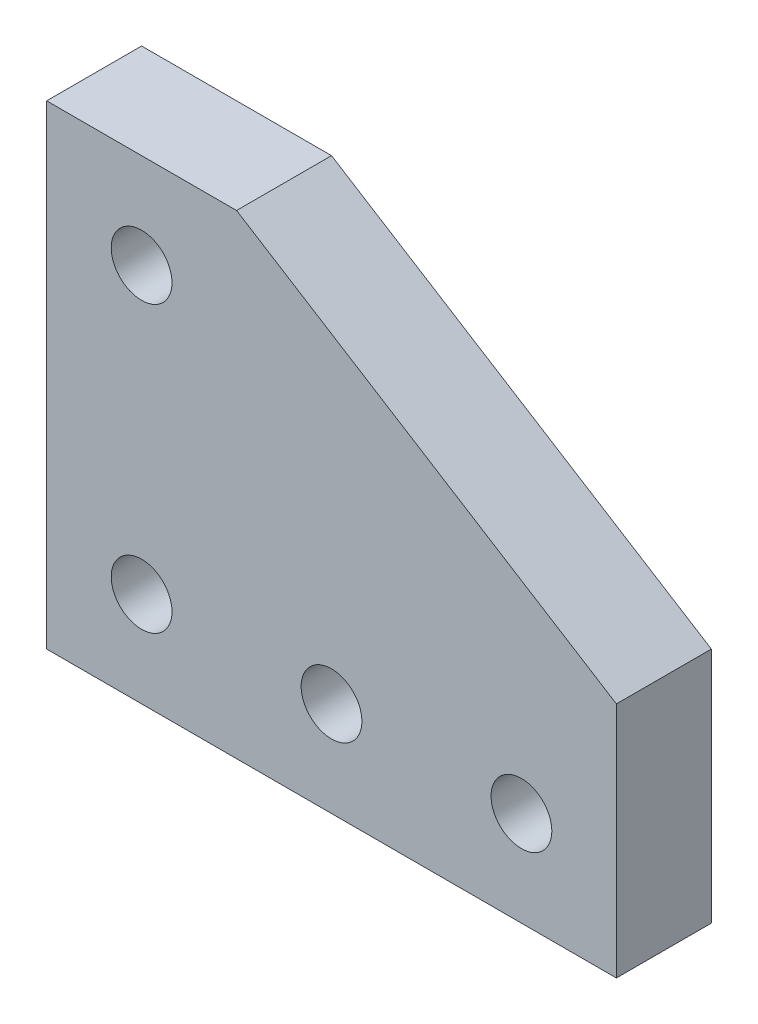
from build123d import *

# Parameters (mm, degrees)
SKETCH1_W               = 30
SKETCH1_H               = 25
BOSS_EXTRUDE1_DEPTH     = 5
CUT_EXTRUDE1_REACH      = 22.156
SKETCH2_R               = 1.6
CUT_EXTRUDE2_DEPTH      = 21.155644371
CUT_EXTRUDE2_DEPTH_BACK = 5


with BuildPart() as part:
    # Sketch1 → Boss-Extrude1 (new body)
    with BuildSketch(Plane.XY):
        Rectangle(SKETCH1_W, SKETCH1_H)
    extrude(amount=BOSS_EXTRUDE1_DEPTH)

    # Sketch2 → Cut-Extrude1 (cut, up to next)
    with BuildSketch(Plane.XY.offset(5), mode=Mode.PRIVATE) as cut_extrude1_sk1:
        with Locations((-10, -7.5)):
            Circle(SKETCH2_R)
    cut_extrude1_tool1 = extrude(cut_extrude1_sk1.sketch, amount=-CUT_EXTRUDE1_REACH, mode=Mode.PRIVATE) & part.part
    # Sketch2 → Cut-Extrude1 (cut, up to next)
    with BuildSketch(Plane.XY.offset(5), mode=Mode.PRIVATE) as cut_extrude1_sk2:
        with Locations((0, -7.5)):
            Circle(SKETCH2_R)
    cut_extrude1_tool2 = extrude(cut_extrude1_sk2.sketch, amount=-CUT_EXTRUDE1_REACH, mode=Mode.PRIVATE) & part.part
    # Sketch2 → Cut-Extrude1 (cut, up to next)
    with BuildSketch(Plane.XY.offset(5), mode=Mode.PRIVATE) as cut_extrude1_sk3:
        with Locations((10, -7.5)):
            Circle(SKETCH2_R)
    cut_extrude1_tool3 = extrude(cut_extrude1_sk3.sketch, amount=-CUT_EXTRUDE1_REACH, mode=Mode.PRIVATE) & part.part
    # Sketch2 → Cut-Extrude1 (cut, up to next)
    with BuildSketch(Plane.XY.offset(5), mode=Mode.PRIVATE) as cut_extrude1_sk4:
        with Locations((-10, 7.5)):
            Circle(SKETCH2_R)
    cut_extrude1_tool4 = extrude(cut_extrude1_sk4.sketch, amount=-CUT_EXTRUDE1_REACH, mode=Mode.PRIVATE) & part.part
    add(cut_extrude1_tool1.solids().sort_by_distance((-10, -7.5, 5))[0], mode=Mode.SUBTRACT)
    add(cut_extrude1_tool2.solids().sort_by_distance((0, -7.5, 5))[0], mode=Mode.SUBTRACT)
    add(cut_extrude1_tool3.solids().sort_by_distance((10, -7.5, 5))[0], mode=Mode.SUBTRACT)
    add(cut_extrude1_tool4.solids().sort_by_distance((-10, 7.5, 5))[0], mode=Mode.SUBTRACT)

    # Sketch3 → Cut-Extrude2 (cut, two sides: drawn at the far end of the back side and taken through both)
    with BuildSketch(Plane.XY.offset(5).offset(-CUT_EXTRUDE2_DEPTH_BACK)):
        Polygon((-68.5998728, 52.2499205), (-5, 12.5), (15, 0), (78.5998728, -39.7499205), (158.099713801, 87.449825101), (10.8999682, 179.449666101), align=None)
    extrude(amount=CUT_EXTRUDE2_DEPTH + CUT_EXTRUDE2_DEPTH_BACK, mode=Mode.SUBTRACT)


solid = part.part
